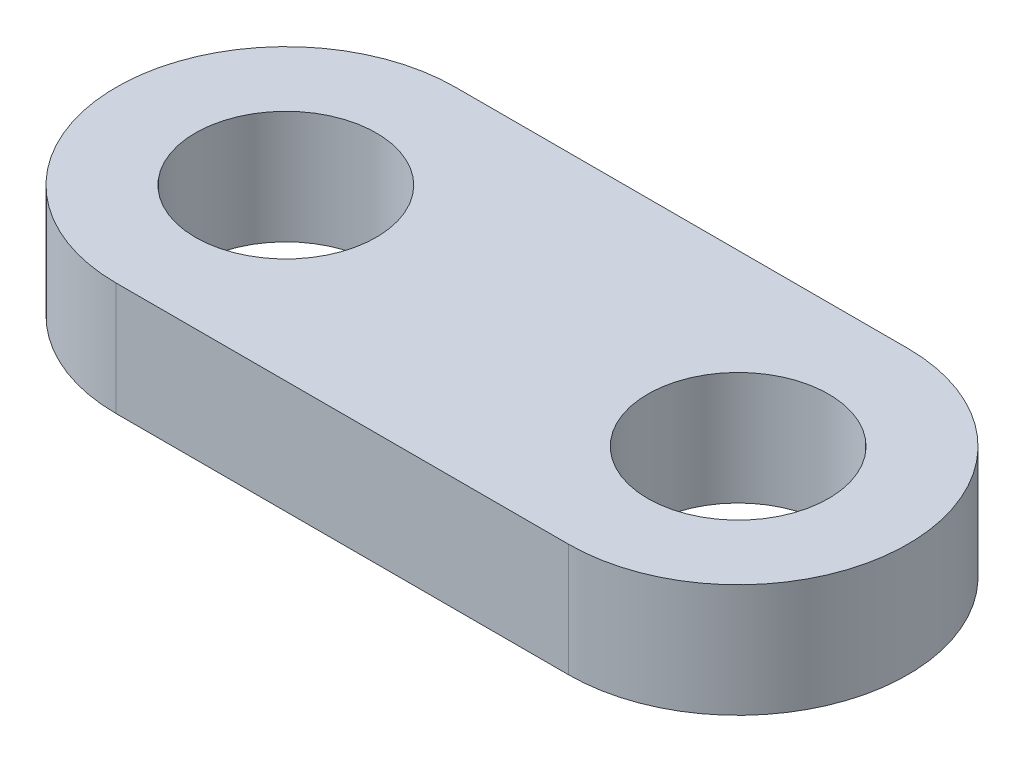
from build123d import *

# Parameters (mm, degrees)
SKETCH_1_R      = 4
EXTRUDE_1_DEPTH = 5


with BuildPart() as part:
    # 草图1 → 凸台-拉伸1 (new body)
    with BuildSketch(Plane(origin=(0, 0, 0), x_dir=(1, 0, 0), z_dir=(0, 1, 0))):
        with BuildLine():
            Line((-10, 7.5), (10, 7.5))
            ThreePointArc((10, 7.5), (17.5, 0), (10, -7.5))
            Line((10, -7.5), (-10, -7.5))
            ThreePointArc((-10, -7.5), (-17.5, 0), (-10, 7.5))
        make_face()
        with Locations(Location((-10, 0, 0), (0, 0, 270))):
            Circle(SKETCH_1_R, mode=Mode.SUBTRACT)
        with Locations(Location((10, 0, 0), (0, 0, 270))):
            Circle(SKETCH_1_R, mode=Mode.SUBTRACT)
    extrude(amount=EXTRUDE_1_DEPTH)


solid = part.part
